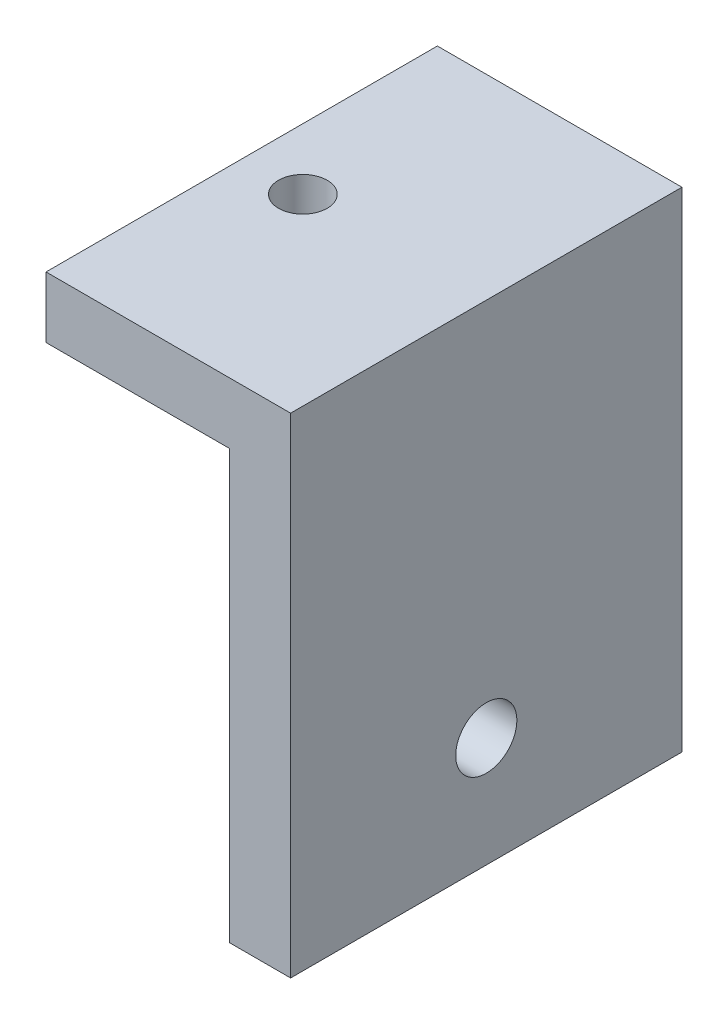
from build123d import *

# Parameters (mm, degrees)
BOSS_EXTRUDE1_DEPTH         = 40.64
F_1_4_0_25_DIAMETER_HOLE1_D = 6.35
F_8_0_199_DIAMETER_HOLE2_D  = 5.0546


with BuildPart() as part:
    # Sketch1 → Boss-Extrude1 (new body)
    with BuildSketch(Plane.XY):
        Polygon((-17.365909091, 21.527272727), (8.034090909, 21.527272727), (8.034090909, 12.565909091), (8.034090909, -29.272727273), (1.684090909, -29.272727273), (1.684090909, 15.177272727), (-17.365909091, 15.177272727), align=None)
    extrude(amount=BOSS_EXTRUDE1_DEPTH)

    # 1/4 (0.25) Diameter Hole1 (through all)
    with Locations(Plane(origin=(8.034090909, 0, 0), x_dir=(0, 0, -1), z_dir=(1, 0, 0))):
        with Locations((-20.32, -17.842727273)):
            Hole(F_1_4_0_25_DIAMETER_HOLE1_D / 2)

    # #8 (0.199) Diameter Hole2 (through all)
    with Locations(Plane(origin=(0, 21.527272727, 0), x_dir=(1, 0, 0), z_dir=(0, 1, 0))):
        with Locations((-11.015909091, -20.32)):
            Hole(F_8_0_199_DIAMETER_HOLE2_D / 2)


solid = part.part
